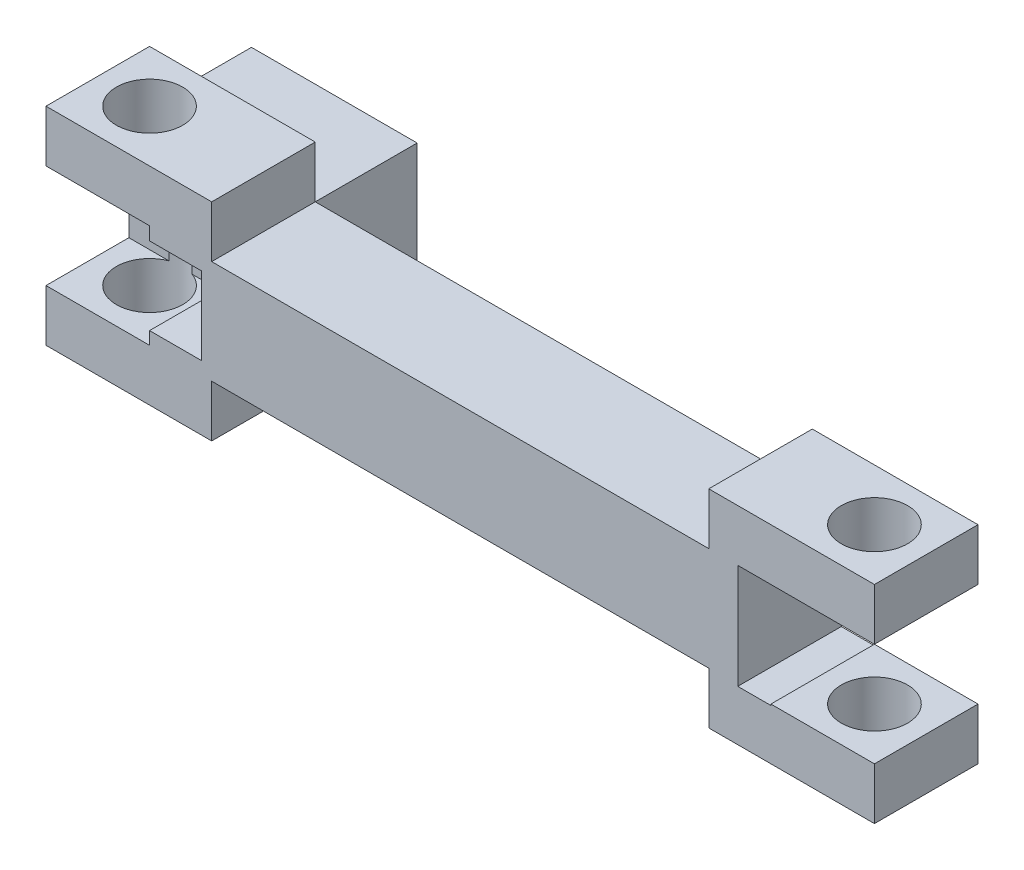
from build123d import *

# Parameters (mm, degrees)
BOSS_EXTRUDE1_DEPTH = 25
SKETCH2_R           = 8
CUT_EXTRUDE1_DEPTH  = 70.5
SKETCH3_R           = 8
CUT_EXTRUDE2_DEPTH  = 88
SKETCH4_W           = 40
SKETCH4_H           = 25
BOSS_EXTRUDE2_DEPTH = 24.6
SKETCH5_R           = 7.5
CUT_EXTRUDE4_DEPTH  = 4.5
SKETCH7_W           = 25
SKETCH7_H           = 25
CUT_EXTRUDE6_DEPTH  = 20
SKETCH10_W          = 25
SKETCH10_H          = 12.5
CUT_EXTRUDE7_DEPTH  = 25
SKETCH13_W          = 12.503220776
SKETCH13_H          = 18.75
CUT_EXTRUDE9_DEPTH  = 25
SKETCH17_W          = 25
SKETCH17_H          = 25.299748734
CUT_EXTRUDE11_DEPTH = 8


with BuildPart() as part:
    # Sketch1 → Boss-Extrude1 (new body)
    with BuildSketch(Plane.XY):
        Polygon((59.2, 45), (-60.8, 45), (-60.8, 57.5), (-100.8, 57.5), (-100.8, 45), (-100.8, 20), (-100.8, 7.5), (-60.8, 7.5), (-60.8, 20), (59.2, 20), (59.2, 7.5), (99.2, 7.5), (99.2, 20), (74.2, 20), (74.2, 45), (99.2, 45), (99.2, 57.5), (59.2, 57.5), align=None)
    extrude(amount=BOSS_EXTRUDE1_DEPTH)

    # Sketch2 → Cut-Extrude1 (cut)
    with BuildSketch(Plane(origin=(0, 57.5, 0), x_dir=(1, 0, 0), z_dir=(0, 1, 0))):
        with Locations(Location((-88.3, -12.5, 0), (0, 0, 180))):
            Circle(SKETCH2_R)
    extrude(amount=-CUT_EXTRUDE1_DEPTH, mode=Mode.SUBTRACT)

    # Sketch3 → Cut-Extrude2 (cut)
    with BuildSketch(Plane(origin=(0, 57.5, 0), x_dir=(1, 0, 0), z_dir=(0, 1, 0))):
        with Locations(Location((86.7, -12.5, 0), (0, 0, 270))):
            Circle(SKETCH3_R)
    extrude(amount=-CUT_EXTRUDE2_DEPTH, mode=Mode.SUBTRACT)

    # Sketch4 → Boss-Extrude2 (add)
    with BuildSketch(Plane(origin=(0, 0, 0), x_dir=(-1, 0, 0), z_dir=(0, 0, -1))):
        with Locations((80.8, 32.5)):
            Rectangle(SKETCH4_W, SKETCH4_H)
    extrude(amount=BOSS_EXTRUDE2_DEPTH)

    # Sketch5 → Cut-Extrude4 (cut)
    with BuildSketch(Plane(origin=(0, 0, -24.6), x_dir=(-1, 0, 0), z_dir=(0, 0, -1))):
        with Locations((85.8, 32.5)):
            Circle(SKETCH5_R)
    extrude(amount=-CUT_EXTRUDE4_DEPTH, mode=Mode.SUBTRACT)

    # Sketch7 → Cut-Extrude6 (cut)
    with BuildSketch(Plane.XY.offset(25)):
        with Locations((-88.3, 32.5)):
            Rectangle(SKETCH7_W, SKETCH7_H)
    extrude(amount=-CUT_EXTRUDE6_DEPTH, mode=Mode.SUBTRACT)

    # Sketch10 → Cut-Extrude7 (cut)
    with BuildSketch(Plane.ZY.offset(100.8)):
        with Locations((0, 32.5)):
            Rectangle(SKETCH10_W, SKETCH10_H)
    extrude(amount=-CUT_EXTRUDE7_DEPTH, mode=Mode.SUBTRACT)

    # Sketch13 → Cut-Extrude9 (cut)
    with BuildSketch(Plane.XY.offset(25)):
        Polygon((-88.295569288, 41.830666142), (-88.296779224, 32.455666142), (-88.296779224, 23.080666142), (-75.8, 23.080666142), (-75.8, 41.830666142), align=None)
        with Locations((-69.548389612, 32.455666142)):
            Rectangle(SKETCH13_W, SKETCH13_H)
    extrude(amount=-CUT_EXTRUDE9_DEPTH, mode=Mode.SUBTRACT)

    # Sketch17 → Cut-Extrude11 (cut)
    with BuildSketch(Plane(origin=(74.2, 0, 0), x_dir=(0, 0, -1), z_dir=(1, 0, 0))):
        with Locations((-12.5, 32.350125633)):
            Rectangle(SKETCH17_W, SKETCH17_H)
    extrude(amount=-CUT_EXTRUDE11_DEPTH, mode=Mode.SUBTRACT)


solid = part.part
